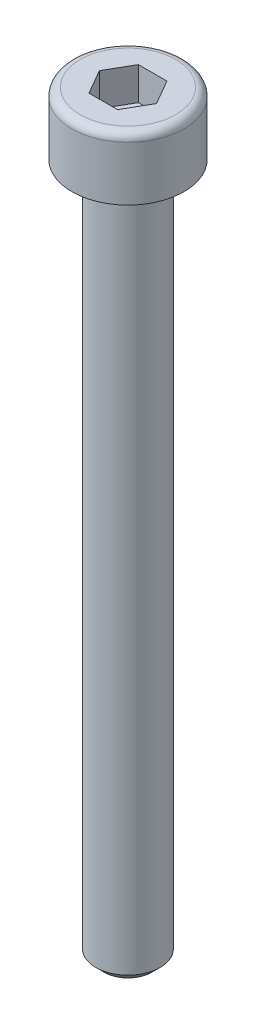
from build123d import *

# Parameters (mm, degrees)
ENL_V_MAT_EXTRU_1_DEPTH = 2


with BuildPart() as part:
    # Esquisse1 → Révolution1 (revolve)
    with BuildSketch(Plane.XY):
        with BuildLine():
            Line((0, 3.8), (-2.9, 3.8))
            ThreePointArc((-2.9, 3.8), (-3.253553391, 3.653553391), (-3.4, 3.3))
            Line((-3.4, 3.3), (-3.4, 0))
            Line((-3.4, 0), (-1.95, 0))
            Line((-1.95, 0), (-1.95, -41.5))
            Line((-1.95, -41.5), (-1.45, -42))
            Line((-1.45, -42), (0, -42))
            Line((0, -42), (0, 3.8))
        make_face()
    revolve(axis=Axis((0, 3.8, 0), (0, -1, 0)))

    # Esquisse2 → Enlèv. mat.-Extru.1 (cut)
    with BuildSketch(Plane(origin=(0, 3.8, 0), x_dir=(-1, 0, 0), z_dir=(0, 1, 0))):
        Polygon((-1.732050808, 0), (-0.866025404, -1.5), (0.866025404, -1.5), (1.732050808, 0), (0.866025404, 1.5), (-0.866025404, 1.5), align=None)
    extrude(amount=-ENL_V_MAT_EXTRU_1_DEPTH, mode=Mode.SUBTRACT)


solid = part.part
